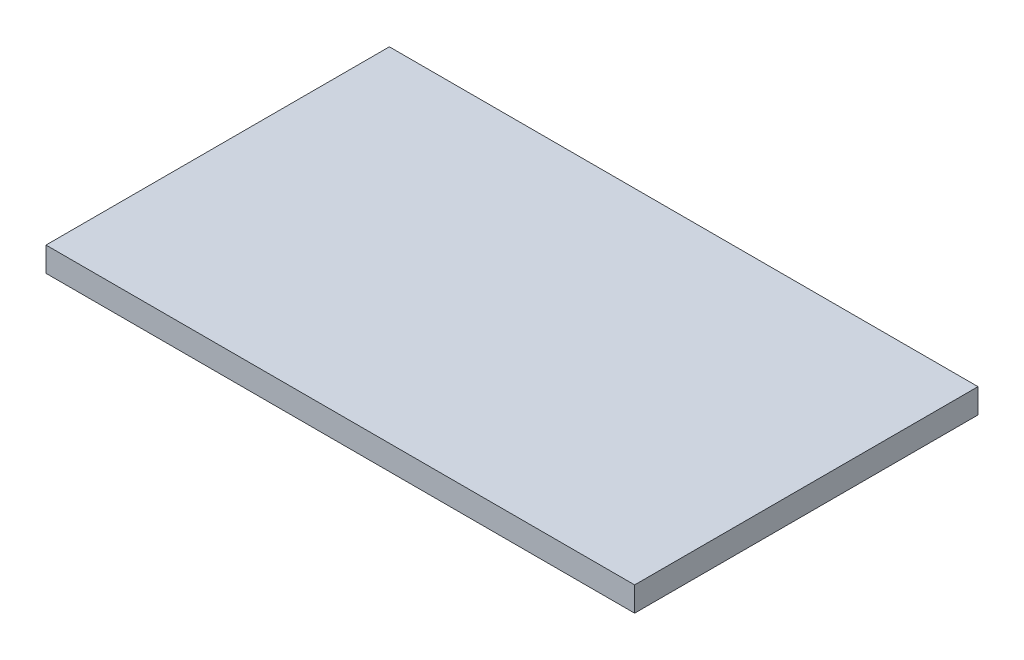
from build123d import *

# Parameters (mm, degrees)
SKETCH_1_W      = 120
SKETCH_1_H      = 70
EXTRUDE_1_DEPTH = 5


with BuildPart() as part:
    # 草图1 → 凸台-拉伸1 (new body)
    with BuildSketch(Plane(origin=(0, 0, 0), x_dir=(1, 0, 0), z_dir=(0, 1, 0))):
        with Locations((60, -35)):
            Rectangle(SKETCH_1_W, SKETCH_1_H)
    extrude(amount=EXTRUDE_1_DEPTH)


solid = part.part
